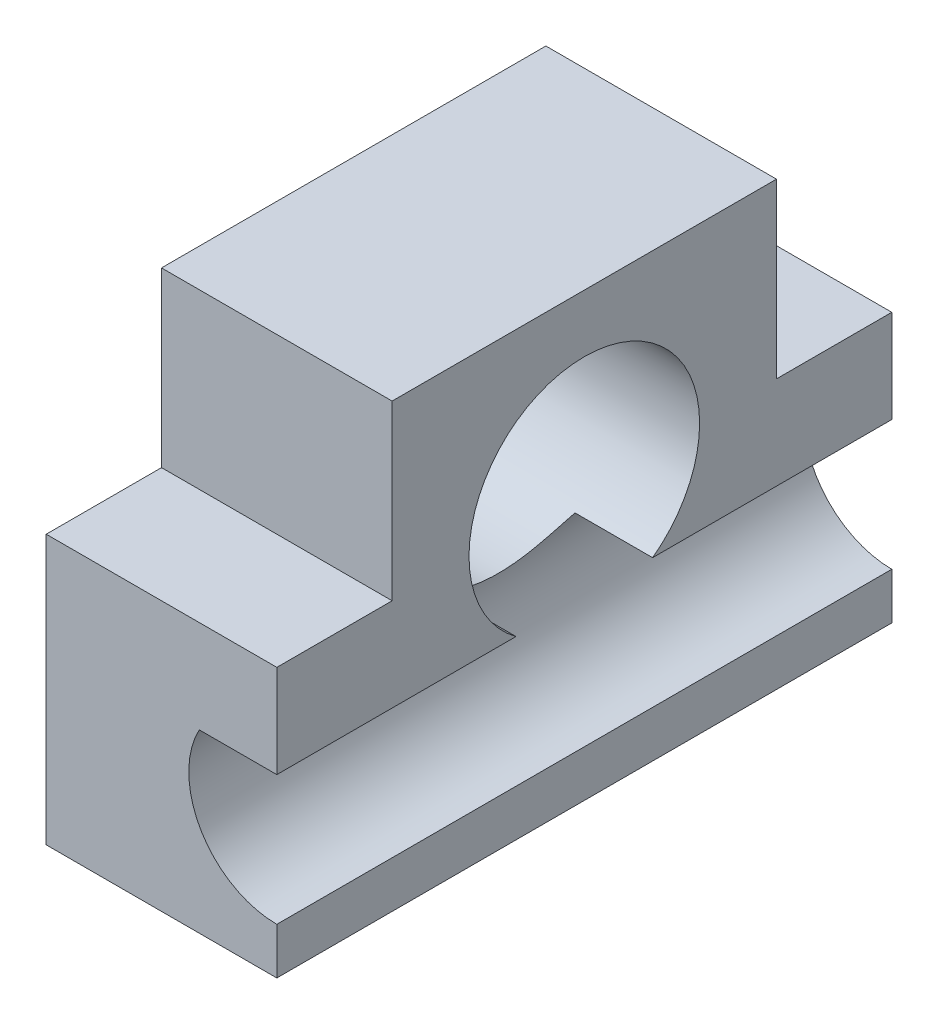
from build123d import *
from build123d.topology import SkipClean

# Parameters (mm, degrees)
SKETCH2_W           = 60
SKETCH2_H           = 35
BOSS_EXTRUDE1_DEPTH = 80
BOSS_EXTRUDE2_REACH = 103.52
SKETCH3_W           = 50
SKETCH3_H           = 45
SKETCH3_R           = 5
SKETCH4_R           = 10.85
CUT_EXTRUDE1_DEPTH  = 80
CUT_EXTRUDE2_START  = -80
CUT_EXTRUDE2_DEPTH  = 80
CUT_EXTRUDE3_DEPTH  = 80
SKETCH8_R           = 15
CUT_EXTRUDE5_DEPTH  = 25


with BuildPart() as part:
    # Sketch2 → Boss-Extrude1 (new body)
    with BuildSketch(Plane.XY):
        Rectangle(SKETCH2_W, SKETCH2_H)
        with BuildLine():
            Line((-10.089226223, 5.413872387), (10.089226223, 5.413872387))
            ThreePointArc((10.089226223, 5.413872387), (0, -11.45), (-10.089226223, 5.413872387))
        make_face(mode=Mode.SUBTRACT)
    extrude(amount=BOSS_EXTRUDE1_DEPTH)

    # Boss-Extrude2: up to this face of the body (flat: up to its plane)
    boss_extrude2_end = Plane(part.part.faces().sort_by_distance((-30, 0, 40))[0])
    # Sketch3 → Boss-Extrude2 (add, up to the picked face)
    with BuildSketch(Plane(origin=(30, 0, 0), x_dir=(0, 0, -1), z_dir=(1, 0, 0)), mode=Mode.PRIVATE) as boss_extrude2_sk1:
        with Locations((-40, 17.5)):
            Rectangle(SKETCH3_W, SKETCH3_H)
        with Locations((-40, 17.5)):
            Circle(SKETCH3_R, mode=Mode.SUBTRACT)
    boss_extrude2_tool1 = split(extrude(boss_extrude2_sk1.sketch, amount=-BOSS_EXTRUDE2_REACH, mode=Mode.PRIVATE), bisect_by=boss_extrude2_end, keep=Keep.BOTH, mode=Mode.PRIVATE)
    add(boss_extrude2_tool1.solids().sort_by(Axis((30, -4.327319, 40), (-1, 0, 0)))[0])

    # Sketch4 → Cut-Extrude1 (cut)
    with BuildSketch(Plane(origin=(30, 0, 0), x_dir=(0, 0, -1), z_dir=(1, 0, 0))):
        with Locations(Location((-40, 17.5, 0), (0, 0, 90))):
            Circle(SKETCH4_R)
    extrude(amount=-CUT_EXTRUDE1_DEPTH, mode=Mode.SUBTRACT)

    # Sketch5 → Cut-Extrude2 (cut)
    with SkipClean():  # the faces are left unmerged after this step: merging them gives an invalid solid
        with BuildSketch(Plane.XY.offset(80).offset(CUT_EXTRUDE2_START)):
            with BuildLine():
                Line((-10.300606778, -5), (10.300606778, -5))
                ThreePointArc((10.300606778, -5), (11.447641983, 0.232363988), (10.089226223, 5.413872387))
                Line((10.089226223, 5.413872387), (-10.089226223, 5.413872387))
                ThreePointArc((-10.089226223, 5.413872387), (-11.447641983, 0.232363988), (-10.300606778, -5))
            make_face()
        extrude(amount=CUT_EXTRUDE2_DEPTH, mode=Mode.SUBTRACT)

    # Sketch6 → Cut-Extrude3 (cut)
    with SkipClean():  # the faces are left unmerged after this step: merging them gives an invalid solid
        with BuildSketch(Plane.XY.offset(80)):
            Polygon((0, 0), (0, 40), (30, 40), (30, -17.5), (0, -17.5), align=None)
        extrude(amount=-CUT_EXTRUDE3_DEPTH, mode=Mode.SUBTRACT)

    # Sketch8 → Cut-Extrude5 (cut)
    with SkipClean():  # the faces are left unmerged after this step: merging them gives an invalid solid
        with BuildSketch(Plane(origin=(0, 0, 0), x_dir=(0, 0, -1), z_dir=(1, 0, 0))):
            with Locations((-40, 17.5)):
                Circle(SKETCH8_R)
        extrude(amount=-CUT_EXTRUDE5_DEPTH, mode=Mode.SUBTRACT)


solid = part.part
